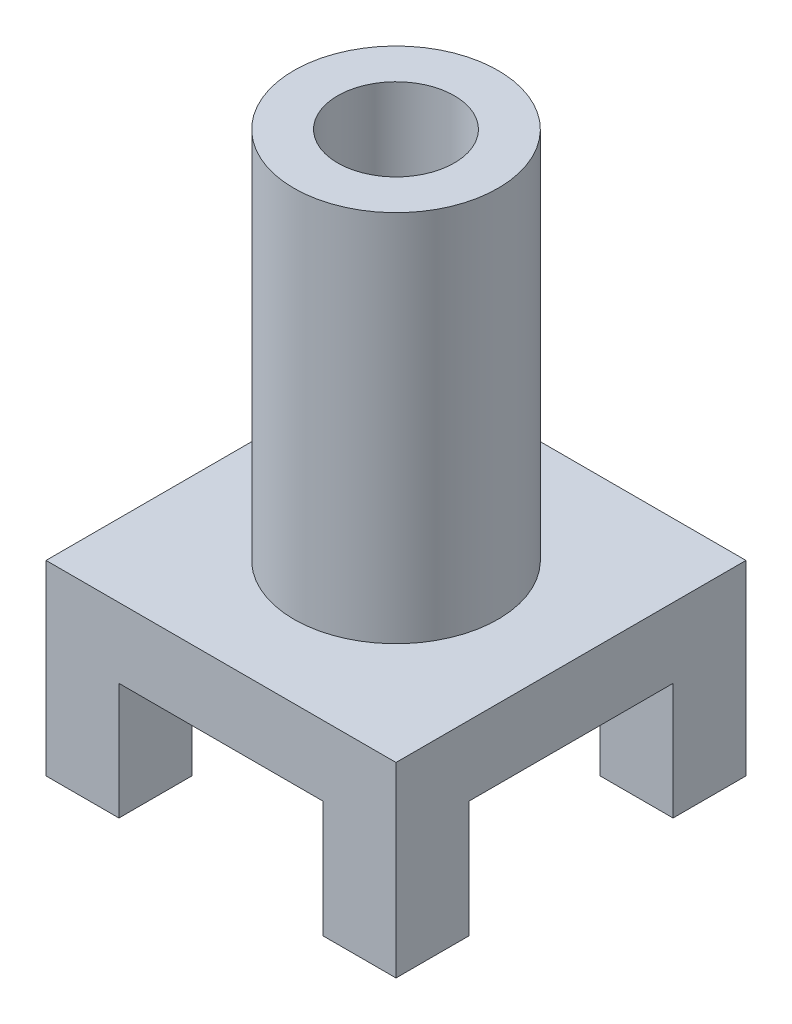
from build123d import *

# Parameters (mm, degrees)
CROQUIS1_W              = 60
CROQUIS1_H              = 60
SALIENTE_EXTRUIR1_DEPTH = 32
CROQUIS2_W              = 35
CROQUIS2_H              = 20
CORTAR_EXTRUIR1_DEPTH   = 75.323616704
CROQUIS3_W              = 35
CROQUIS3_H              = 20
CORTAR_EXTRUIR2_DEPTH   = 75.323616704
CROQUIS4_R              = 17.5
SALIENTE_EXTRUIR2_DEPTH = 64
CROQUIS5_R              = 10
CORTAR_EXTRUIR5_DEPTH   = 105.957134107


with BuildPart() as part:
    # Croquis1 → Saliente-Extruir1 (new body)
    with BuildSketch(Plane(origin=(0, 0, 0), x_dir=(1, 0, 0), z_dir=(0, 1, 0))):
        Rectangle(CROQUIS1_W, CROQUIS1_H)
    extrude(amount=SALIENTE_EXTRUIR1_DEPTH)

    # Croquis2 → Cortar-Extruir1 (cut, through all)
    with BuildSketch(Plane(origin=(30, 0, 0), x_dir=(0, 0, -1), z_dir=(1, 0, 0))):
        with Locations((0, 10)):
            Rectangle(CROQUIS2_W, CROQUIS2_H)
    extrude(amount=-CORTAR_EXTRUIR1_DEPTH, mode=Mode.SUBTRACT)

    # Croquis3 → Cortar-Extruir2 (cut, through all)
    with BuildSketch(Plane.XY.offset(30)):
        with Locations((0, 10)):
            Rectangle(CROQUIS3_W, CROQUIS3_H)
    extrude(amount=-CORTAR_EXTRUIR2_DEPTH, mode=Mode.SUBTRACT)

    # Croquis4 → Saliente-Extruir2 (add)
    with BuildSketch(Plane(origin=(0, 32, 0), x_dir=(1, 0, 0), z_dir=(0, 1, 0))):
        with Locations(Location((0, 0, 0), (0, 0, 270))):
            Circle(CROQUIS4_R)
    extrude(amount=SALIENTE_EXTRUIR2_DEPTH)

    # Croquis5 → Cortar-Extruir5 (cut, through all)
    with BuildSketch(Plane(origin=(0, 96, 0), x_dir=(1, 0, 0), z_dir=(0, 1, 0))):
        with Locations(Location((0, 0, 0), (0, 0, 270))):
            Circle(CROQUIS5_R)
    extrude(amount=-CORTAR_EXTRUIR5_DEPTH, mode=Mode.SUBTRACT)


solid = part.part
